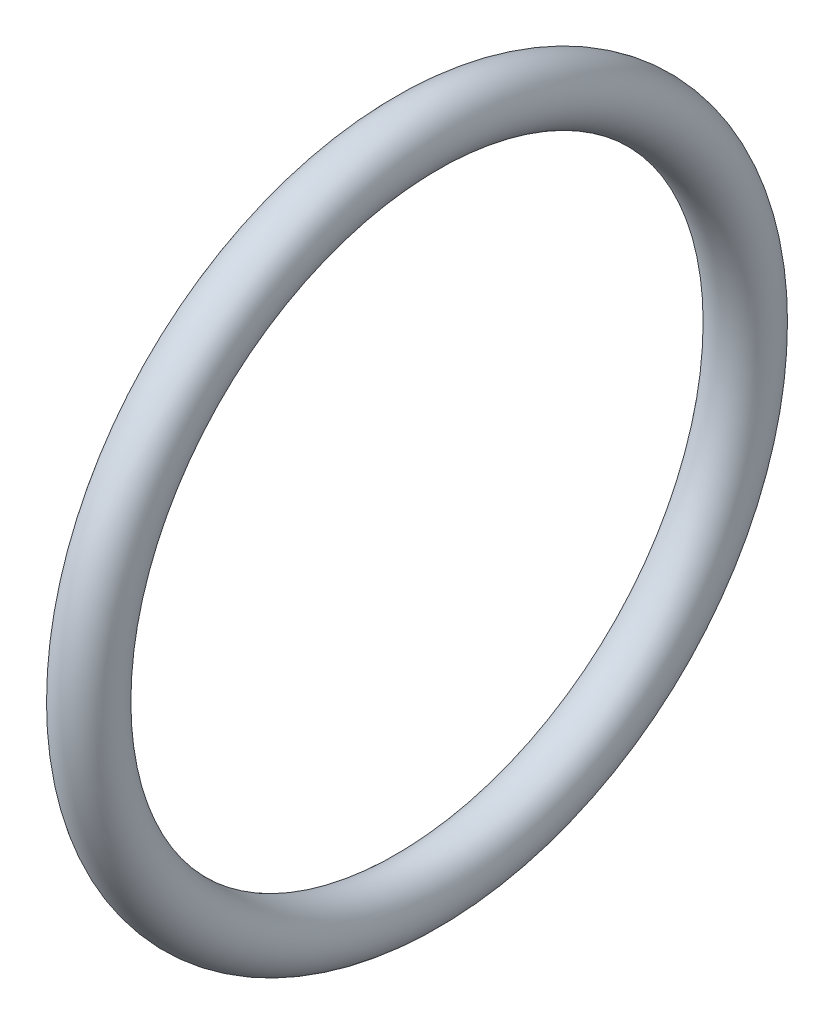
from build123d import *

# Parameters (mm, degrees)
SKETCH_1_R = 2.5


with BuildPart() as part:
    # 草图1 → 旋转1 (revolve)
    with BuildSketch(Plane.XY, mode=Mode.PRIVATE) as revolve_1_sk:
        with Locations((0, 27.5)):
            Circle(SKETCH_1_R)
    revolve(revolve_1_sk.sketch.rotate(Axis((-20.884003278, 0, 0), (1, 0, 0)), 90), axis=Axis((-20.884003278, 0, 0), (1, 0, 0)))


solid = part.part
